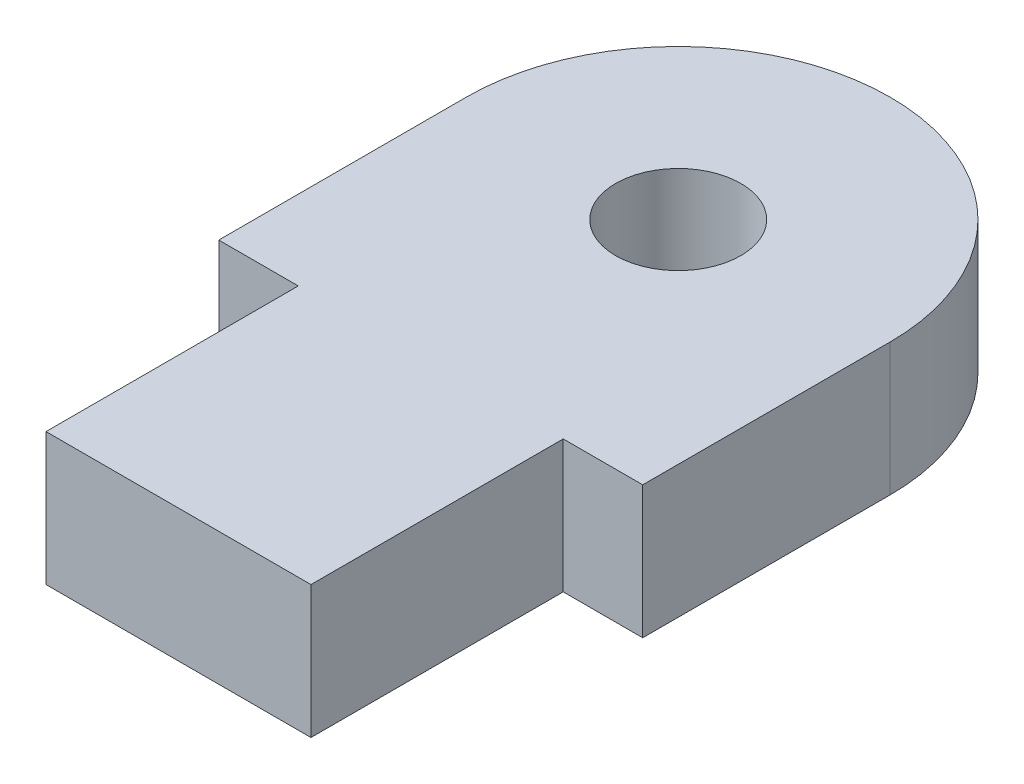
from build123d import *

# Parameters (mm, degrees)
SKETCH1_R           = 1.5
BOSS_EXTRUDE1_DEPTH = 3.175


with BuildPart() as part:
    # Sketch1 → Boss-Extrude1 (new body)
    with BuildSketch(Plane(origin=(0, 0, 0), x_dir=(1, 0, 0), z_dir=(0, 1, 0))):
        with BuildLine():
            Line((-5.08, 0), (-5.08, -5.9309))
            Line((-5.08, -5.9309), (-3.175, -5.9309))
            Line((-3.175, -5.9309), (-3.175, -11.9761))
            Line((-3.175, -11.9761), (3.175, -11.9761))
            Line((3.175, -11.9761), (3.175, -5.9309))
            Line((3.175, -5.9309), (5.08, -5.9309))
            Line((5.08, -5.9309), (5.08, 0))
            ThreePointArc((5.08, 0), (0, 5.08), (-5.08, 0))
        make_face()
        with Locations(Location((0, 0, 0), (0, 0, 270))):
            Circle(SKETCH1_R, mode=Mode.SUBTRACT)
    extrude(amount=BOSS_EXTRUDE1_DEPTH)


solid = part.part
